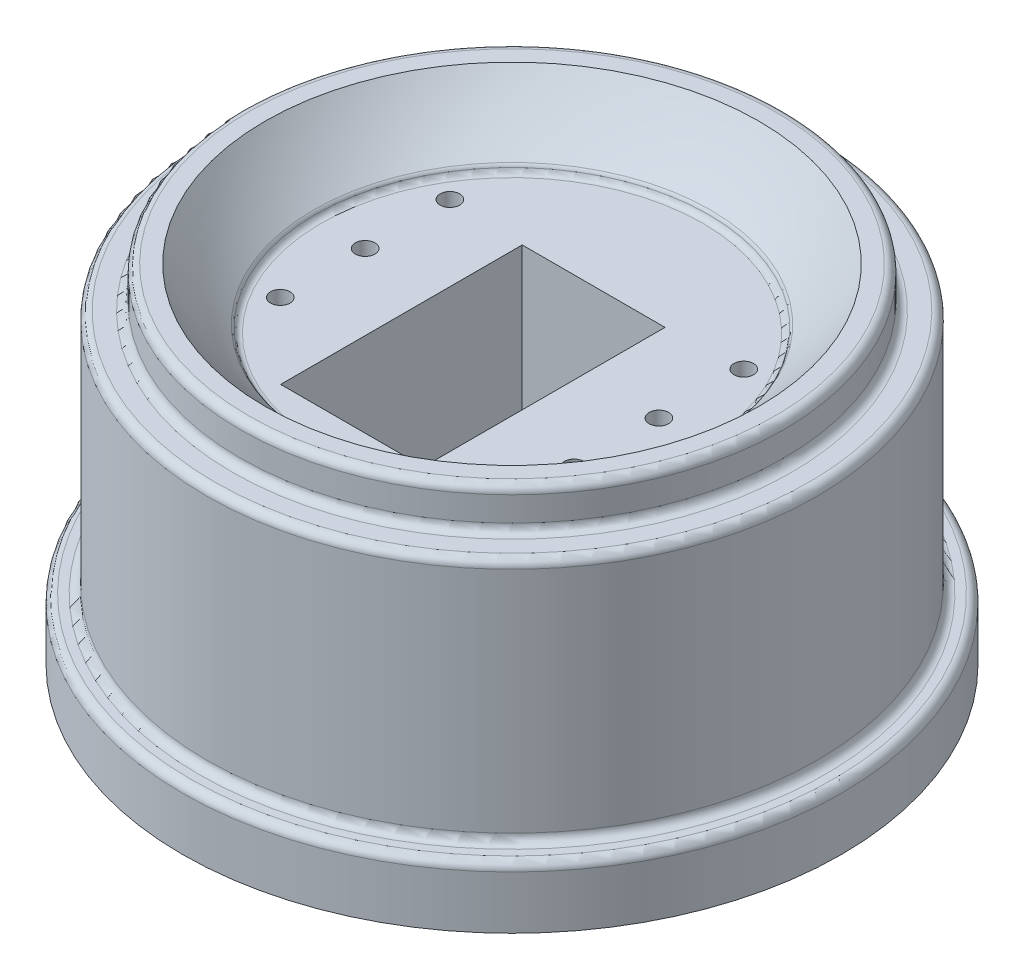
from build123d import *

# Parameters (mm, degrees)
FILLET1_R                                           = 2
FILLET2_R                                           = 2
SKETCH2_W                                           = 62
SKETCH2_H                                           = 31.2
CUT_EXTRUDE1_DEPTH                                  = 33
SKETCH3_W                                           = 82
SKETCH3_H                                           = 114
CUT_EXTRUDE2_DEPTH                                  = 3
FILLET3_R                                           = 10
CUT_EXTRUDE3_START                                  = -3
SKETCH2_3_W                                         = 62
SKETCH2_3_H                                         = 31.2
CUT_EXTRUDE3_DEPTH                                  = 16
SKETCH2_4_W                                         = 62
SKETCH2_4_H                                         = 31.6
CUT_EXTRUDE4_DEPTH                                  = 33
CUT_EXTRUDE5_REACH                                  = 127.48
SKETCH6_W                                           = 35
SKETCH6_H                                           = 59.2
CUT_EXTRUDE5_DIRECTION_2_REACH                      = 127.48
CBORE_FOR_M4_HEX_SOCKET_HEAD_CAP_SCREW1_D           = 4.8
CBORE_FOR_M4_HEX_SOCKET_HEAD_CAP_SCREW1_CBORE_D     = 8
CBORE_FOR_M4_HEX_SOCKET_HEAD_CAP_SCREW1_CBORE_DEPTH = 7.4


with BuildPart() as part:
    # Sketch1 → Revolve1 (revolve)
    with BuildSketch(Plane.XY, mode=Mode.PRIVATE) as revolve1_sk:
        with BuildLine():
            Line((0, -58.609702547), (46.729082253, -58.609702547))
            ThreePointArc((46.729082253, -58.609702547), (47.641233274, -58.300492417), (48.177322515, -57.500343233))
            ThreePointArc((48.177322515, -57.500343233), (48.356911119, -57.090657128), (48.649322197, -56.752144892))
            ThreePointArc((48.649322197, -56.752144892), (54.968977755, -50.655443781), (60.530066847, -43.859702547))
            Line((60.530066847, -43.859702547), (66.530066847, -43.859702547))
            Line((66.530066847, -43.859702547), (66.530066847, -53.859702547))
            Line((66.530066847, -53.859702547), (74.75, -53.859702547))
            Line((74.75, -53.859702547), (74.75, -113.859702547))
            Line((74.75, -113.859702547), (80.75, -113.859702547))
            Line((80.75, -113.859702547), (80.75, -128.859702547))
            Line((80.75, -128.859702547), (0, -128.859702547))
            Line((0, -128.859702547), (0, -58.609702547))
        make_face()
    revolve(revolve1_sk.sketch.rotate(Axis((0, -128.859702547, 0), (0, 1, 0)), 90), axis=Axis((0, -128.859702547, 0), (0, 1, 0)))

    # Fillet1
    fillet1_edges = [part.edges().sort_by_distance(p)[0] for p in [
        (0, -53.859702547, 74.75),
        (0, -113.859702547, 80.75),
        (0, -43.859702547, 66.530066847),
    ]]
    fillet(fillet1_edges, radius=FILLET1_R)

    # Fillet2
    fillet2_edges = [part.edges().sort_by_distance(p)[0] for p in [
        (0, -53.859702547, 66.530066847),
        (0, -113.859702547, 74.75),
    ]]
    fillet(fillet2_edges, radius=FILLET2_R)

    # Sketch2 → Cut-Extrude1 (cut)
    with BuildSketch(Plane.XZ.offset(128.859702547)):
        with Locations((0, 31.4)):
            Rectangle(SKETCH2_W, SKETCH2_H)
    extrude(amount=-CUT_EXTRUDE1_DEPTH, mode=Mode.SUBTRACT)

    # Sketch3 → Cut-Extrude2 (cut)
    with BuildSketch(Plane.XZ.offset(128.859702547)):
        Rectangle(SKETCH3_W, SKETCH3_H)
    extrude(amount=-CUT_EXTRUDE2_DEPTH, mode=Mode.SUBTRACT)

    # Fillet3
    fillet3_edges = [part.edges().sort_by_distance(p)[0] for p in [
        (-41, -127.359702547, -57),
        (-41, -127.359702547, 57),
        (41, -127.359702547, 57),
        (41, -127.359702547, -57),
    ]]
    fillet(fillet3_edges, radius=FILLET3_R)

    # Sketch2<3> → Cut-Extrude3 (cut)
    with BuildSketch(Plane.XZ.offset(128.859702547).offset(CUT_EXTRUDE3_START)):
        with Locations((0, -31.4)):
            Rectangle(SKETCH2_3_W, SKETCH2_3_H)
    extrude(amount=-CUT_EXTRUDE3_DEPTH, mode=Mode.SUBTRACT)

    # Sketch2<4> → Cut-Extrude4 (cut)
    with BuildSketch(Plane.XZ.offset(128.859702547)):
        Rectangle(SKETCH2_4_W, SKETCH2_4_H)
    extrude(amount=-CUT_EXTRUDE4_DEPTH, mode=Mode.SUBTRACT)

    # Sketch6 → Cut-Extrude5 (cut, up to next)
    with BuildSketch(Plane(origin=(0, -95.859702547, 0), x_dir=(-1, 0, 0), z_dir=(0, -1, 0)), mode=Mode.PRIVATE) as cut_extrude5_sk1:
        with Locations((0, -9.6)):
            Rectangle(SKETCH6_W, SKETCH6_H)
    cut_extrude5_tool1 = extrude(cut_extrude5_sk1.sketch, amount=-CUT_EXTRUDE5_REACH, mode=Mode.PRIVATE) & part.part
    add(cut_extrude5_tool1.solids().sort_by_distance((0, -95.859703, 9.6))[0], mode=Mode.SUBTRACT)

    # Sketch6 → Cut-Extrude5 direction 2 (cut, up to next)
    with BuildSketch(Plane(origin=(0, -95.859702547, 0), x_dir=(-1, 0, 0), z_dir=(0, -1, 0)), mode=Mode.PRIVATE) as cut_extrude5_direction_2_sk1:
        with Locations((0, -9.6)):
            Rectangle(SKETCH6_W, SKETCH6_H)
    cut_extrude5_direction_2_tool1 = extrude(cut_extrude5_direction_2_sk1.sketch, amount=CUT_EXTRUDE5_DIRECTION_2_REACH, mode=Mode.PRIVATE) & part.part
    add(cut_extrude5_direction_2_tool1.solids().sort_by_distance((0, -95.859703, 9.6))[0], mode=Mode.SUBTRACT)

    # CBORE for M4 Hex Socket Head Cap Screw1 (through all)
    with Locations(Plane(origin=(0, -128.859702547, 0), x_dir=(-1, 0, 0), z_dir=(0, -1, 0))):
        with Locations((-36, 0), (-36, -20.784609691), (-36, 20.784609691), (36, 20.784609691), (36, 0), (36, -20.784609691)):
            CounterBoreHole(CBORE_FOR_M4_HEX_SOCKET_HEAD_CAP_SCREW1_D / 2, CBORE_FOR_M4_HEX_SOCKET_HEAD_CAP_SCREW1_CBORE_D / 2, CBORE_FOR_M4_HEX_SOCKET_HEAD_CAP_SCREW1_CBORE_DEPTH)


solid = part.part
